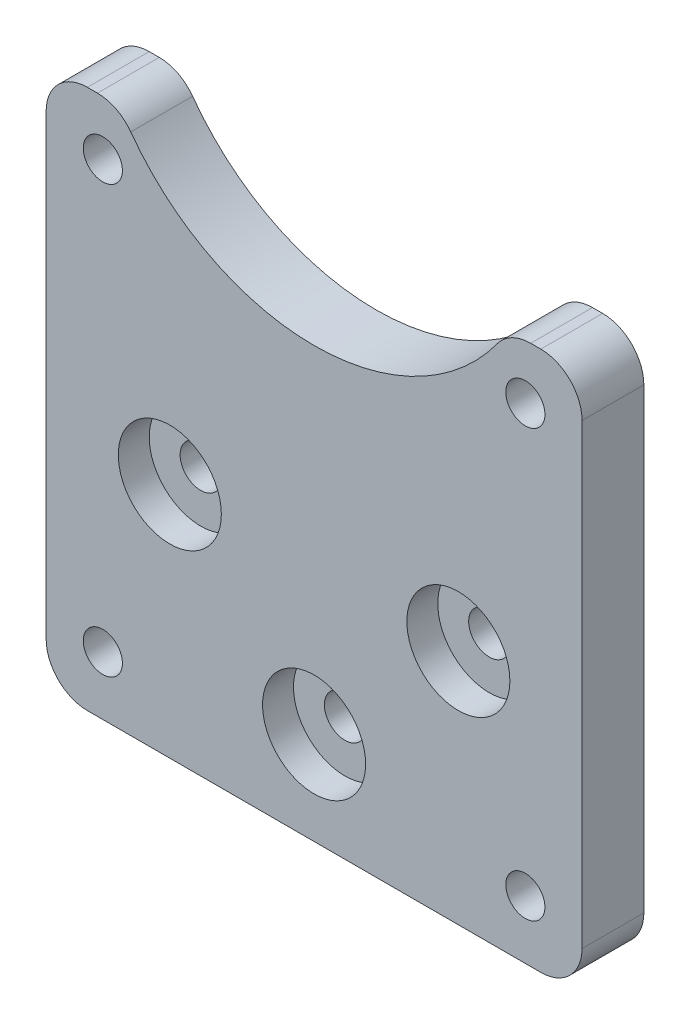
from build123d import *

# Parameters (mm, degrees)
SKETCH_1_R          = 1
SKETCH_1_R_2        = 0.95
EXTRUDE_1_DEPTH     = 3
SKETCH_2_R          = 2.5
CUT_EXTRUDE_1_DEPTH = 1.5
FILLET_1_R          = 2


with BuildPart() as part:
    # 草图1 → 凸台-拉伸1 (new body)
    with BuildSketch(Plane.XY):
        with BuildLine():
            Line((-13, -8), (13, -8))
            Line((13, -8), (13, 18.190012112))
            Line((13, 18.190012112), (9.43808773, 18.190012112))
            ThreePointArc((9.43808773, 18.190012112), (0, 12.840012112), (-9.43808773, 18.190012112))
            Line((-9.43808773, 18.190012112), (-13, 18.190012112))
            Line((-13, 18.190012112), (-13, -8))
        make_face()
        with Locations((7, 3.5)):
            Circle(SKETCH_1_R, mode=Mode.SUBTRACT)
        with Locations(Location((-7, 3.5, 0), (0, 0, 180))):
            Circle(SKETCH_1_R, mode=Mode.SUBTRACT)
        with Locations((0, -3.5)):
            Circle(SKETCH_1_R, mode=Mode.SUBTRACT)
        with Locations((10.25, 15.540012112)):
            Circle(SKETCH_1_R_2, mode=Mode.SUBTRACT)
        with Locations(Location((-10.25, 15.540012112, 0), (0, 0, 180))):
            Circle(SKETCH_1_R_2, mode=Mode.SUBTRACT)
        with Locations((-10.25, -5.159987888)):
            Circle(SKETCH_1_R_2, mode=Mode.SUBTRACT)
        with Locations(Location((10.25, -5.159987888, 0), (0, 0, 180))):
            Circle(SKETCH_1_R_2, mode=Mode.SUBTRACT)
    extrude(amount=EXTRUDE_1_DEPTH)

    # 草图2 → 切除-拉伸1 (cut)
    with BuildSketch(Plane.XY.offset(3)):
        with Locations((-7, 3.5)):
            Circle(SKETCH_2_R)
        with Locations((7, 3.5)):
            Circle(SKETCH_2_R)
        with Locations((0, -3.5)):
            Circle(SKETCH_2_R)
    extrude(amount=-CUT_EXTRUDE_1_DEPTH, mode=Mode.SUBTRACT)

    # 圆角1
    fillet_1_edges = [part.edges().sort_by_distance(p)[0] for p in [
        (13, -8, 1.5),
        (-13, -8, 1.5),
        (-13, 18.190012112, 1.5),
        (-9.43808773, 18.190012112, 1.5),
        (9.43808773, 18.190012112, 1.5),
        (13, 18.190012112, 1.5),
    ]]
    fillet(fillet_1_edges, radius=FILLET_1_R)


solid = part.part
